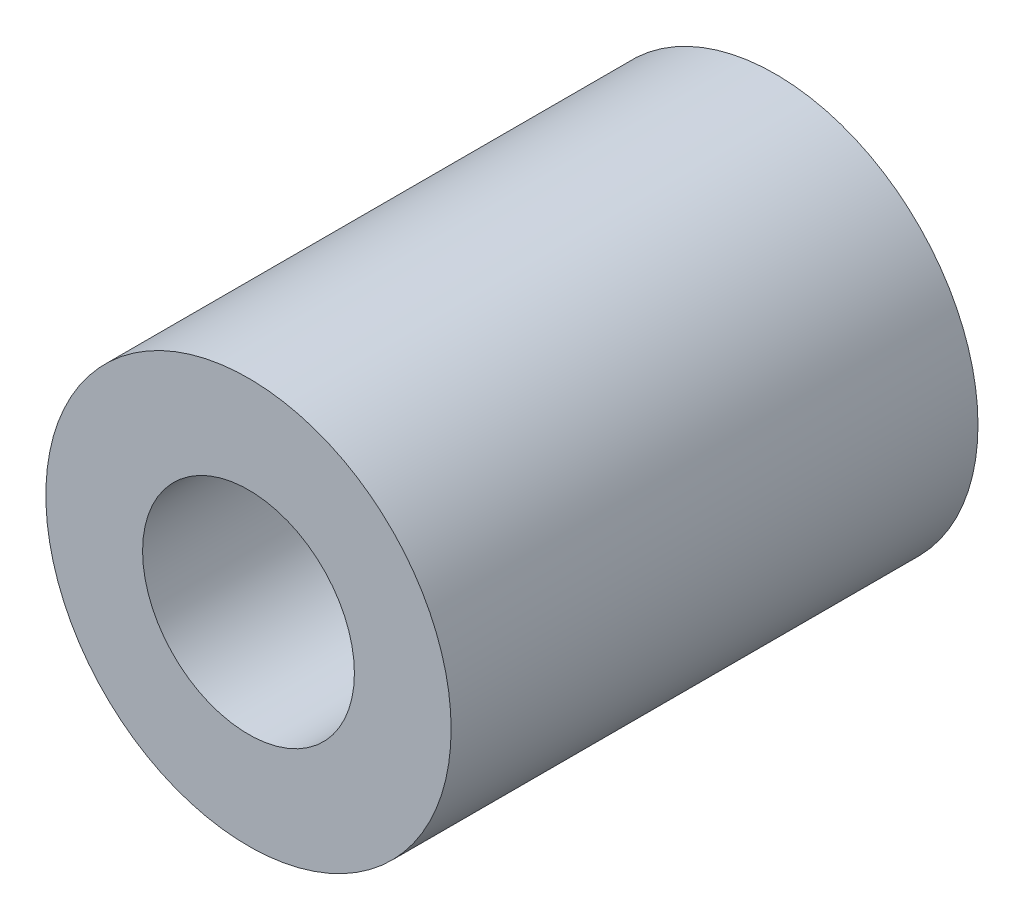
from build123d import *

# Parameters (mm, degrees)
SKETCH1_R           = 4.7625
SKETCH1_R_2         = 2.4892
BOSS_EXTRUDE1_DEPTH = 6.19125


with BuildPart() as part:
    # Sketch1 → Boss-Extrude1 (new, symmetric)
    with BuildSketch(Plane.XY):
        Circle(SKETCH1_R)
        Circle(SKETCH1_R_2, mode=Mode.SUBTRACT)
    extrude(amount=BOSS_EXTRUDE1_DEPTH, both=True)


solid = part.part
